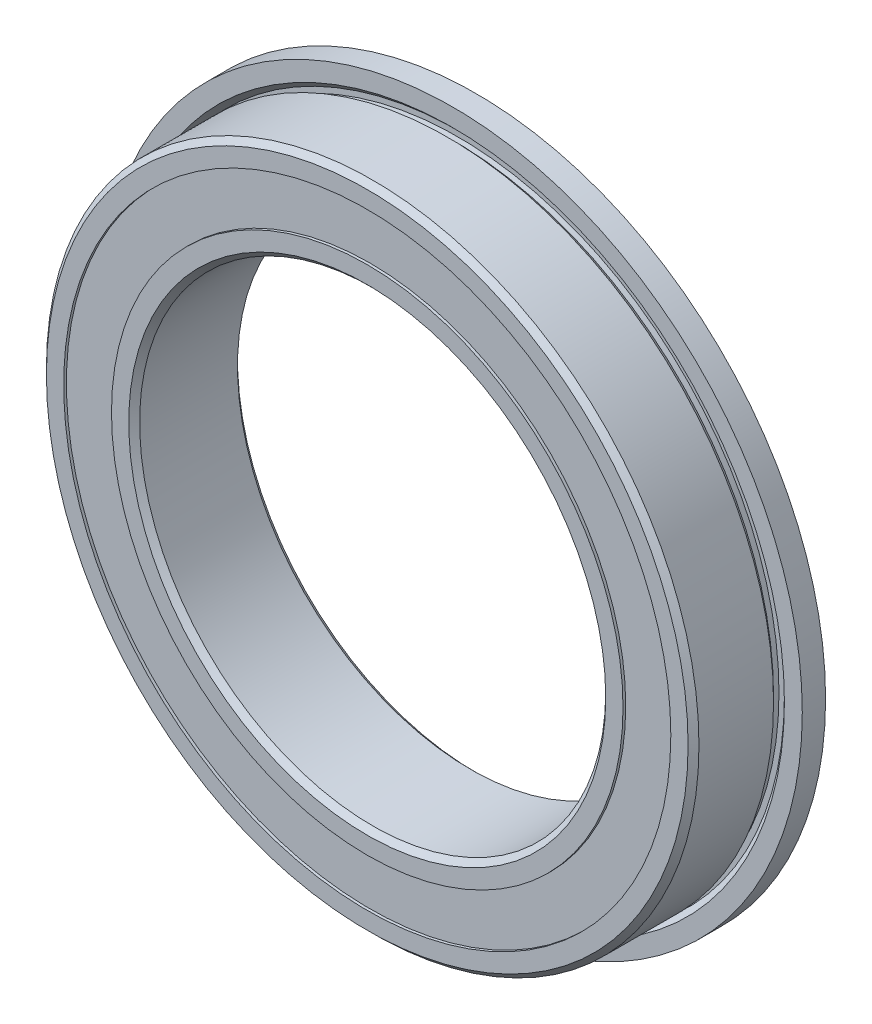
from build123d import *

# Parameters (mm, degrees)
SKETCH6_W         = 0.512820512
SKETCH6_H         = 1.538461538
CIRPATTERN1_COUNT = 17
SKETCH5_W         = 1.137166142
SKETCH5_H         = 3.076923076


with BuildPart() as part:
    # Sketch7 → Revolve7 (revolve)
    with BuildSketch(Plane(origin=(0, 0, 0), x_dir=(0, 0, -1), z_dir=(1, 0, 0))):
        with BuildLine():
            Line((3.5, 22.5), (2, 22.5))
            Line((2, 22.5), (2, 21.35))
            Line((2, 21.35), (2.35, 21))
            Line((2.35, 21), (2.35, 20.65))
            Line((2.35, 20.65), (2, 20.65))
            Line((2, 20.65), (1.65, 21))
            Line((1.65, 21), (-3.15, 21))
            Line((-3.15, 21), (-3.5, 20.65))
            Line((-3.5, 20.65), (-3.5, 19.538461538))
            Line((-3.5, 19.538461538), (-1.555555556, 19.538461538))
            ThreePointArc((-1.555555556, 19.538461538), (0, 20.187833858), (1.555555556, 19.538461538))
            Line((1.555555556, 19.538461538), (3.5, 19.538461538))
            Line((3.5, 19.538461538), (3.5, 20.65))
            Line((3.5, 20.65), (3.5, 22.5))
        make_face()
    revolve(axis=Axis((0, 0, 3.5), (0, 0, -1)))


with BuildPart() as body_2:
    # Sketch3 → Revolve3 (revolve)
    with BuildSketch(Plane(origin=(0, 0, 0), x_dir=(0, 0, -1), z_dir=(1, 0, 0))):
        with BuildLine():
            Line((-3.5, 16.461538462), (-1.555555556, 16.461538462))
            ThreePointArc((-1.555555556, 16.461538462), (0, 15.812166142), (1.555555556, 16.461538462))
            Line((1.555555556, 16.461538462), (3.5, 16.461538462))
            Line((3.5, 16.461538462), (3.5, 15.35))
            Line((3.5, 15.35), (3.15, 15))
            Line((3.15, 15), (-3.15, 15))
            Line((-3.15, 15), (-3.5, 15.35))
            Line((-3.5, 15.35), (-3.5, 16.461538462))
        make_face()
    revolve(axis=Axis((0, 0, 3.5), (0, 0, -1)))


with BuildPart() as body_3:
    # Sketch6 → Revolve6 (revolve)
    with BuildSketch(Plane(origin=(0, 0, 0), x_dir=(0, 0, -1), z_dir=(1, 0, 0))):
        with Locations((0, 18)):
            Rectangle(SKETCH6_W, SKETCH6_H)
    revolve(axis=Axis((0, 0, 3.5), (0, 0, -1)))


with BuildPart() as body_4:
    # Sketch4 → Revolve4 (revolve)
    with BuildSketch(Plane(origin=(0, 0, 0), x_dir=(0, 0, -1), z_dir=(1, 0, 0))):
        with BuildLine():
            Line((-2.187833858, 18), (2.187833858, 18))
            ThreePointArc((2.187833858, 18), (0, 20.187833858), (-2.187833858, 18))
        make_face()
    revolve(axis=Axis((0, 18, 2.187833858), (0, 0, -1)))


with BuildPart() as cirpattern1_1:
    # CirPattern1: pattern copy
    add(body_4.part.rotate(Axis((0, 0, -3.5), (0, 0, 1)), 1 * 360 / CIRPATTERN1_COUNT))


with BuildPart() as cirpattern1_2:
    # CirPattern1: pattern copy
    add(body_4.part.rotate(Axis((0, 0, -3.5), (0, 0, 1)), 2 * 360 / CIRPATTERN1_COUNT))


with BuildPart() as cirpattern1_3:
    # CirPattern1: pattern copy
    add(body_4.part.rotate(Axis((0, 0, -3.5), (0, 0, 1)), 3 * 360 / CIRPATTERN1_COUNT))


with BuildPart() as cirpattern1_4:
    # CirPattern1: pattern copy
    add(body_4.part.rotate(Axis((0, 0, -3.5), (0, 0, 1)), 4 * 360 / CIRPATTERN1_COUNT))


with BuildPart() as cirpattern1_5:
    # CirPattern1: pattern copy
    add(body_4.part.rotate(Axis((0, 0, -3.5), (0, 0, 1)), 5 * 360 / CIRPATTERN1_COUNT))


with BuildPart() as cirpattern1_6:
    # CirPattern1: pattern copy
    add(body_4.part.rotate(Axis((0, 0, -3.5), (0, 0, 1)), 6 * 360 / CIRPATTERN1_COUNT))


with BuildPart() as cirpattern1_7:
    # CirPattern1: pattern copy
    add(body_4.part.rotate(Axis((0, 0, -3.5), (0, 0, 1)), 7 * 360 / CIRPATTERN1_COUNT))


with BuildPart() as cirpattern1_8:
    # CirPattern1: pattern copy
    add(body_4.part.rotate(Axis((0, 0, -3.5), (0, 0, 1)), 8 * 360 / CIRPATTERN1_COUNT))


with BuildPart() as cirpattern1_9:
    # CirPattern1: pattern copy
    add(body_4.part.rotate(Axis((0, 0, -3.5), (0, 0, 1)), 9 * 360 / CIRPATTERN1_COUNT))


with BuildPart() as cirpattern1_10:
    # CirPattern1: pattern copy
    add(body_4.part.rotate(Axis((0, 0, -3.5), (0, 0, 1)), 10 * 360 / CIRPATTERN1_COUNT))


with BuildPart() as cirpattern1_11:
    # CirPattern1: pattern copy
    add(body_4.part.rotate(Axis((0, 0, -3.5), (0, 0, 1)), 11 * 360 / CIRPATTERN1_COUNT))


with BuildPart() as cirpattern1_12:
    # CirPattern1: pattern copy
    add(body_4.part.rotate(Axis((0, 0, -3.5), (0, 0, 1)), 12 * 360 / CIRPATTERN1_COUNT))


with BuildPart() as cirpattern1_13:
    # CirPattern1: pattern copy
    add(body_4.part.rotate(Axis((0, 0, -3.5), (0, 0, 1)), 13 * 360 / CIRPATTERN1_COUNT))


with BuildPart() as cirpattern1_14:
    # CirPattern1: pattern copy
    add(body_4.part.rotate(Axis((0, 0, -3.5), (0, 0, 1)), 14 * 360 / CIRPATTERN1_COUNT))


with BuildPart() as cirpattern1_15:
    # CirPattern1: pattern copy
    add(body_4.part.rotate(Axis((0, 0, -3.5), (0, 0, 1)), 15 * 360 / CIRPATTERN1_COUNT))


with BuildPart() as cirpattern1_16:
    # CirPattern1: pattern copy
    add(body_4.part.rotate(Axis((0, 0, -3.5), (0, 0, 1)), 16 * 360 / CIRPATTERN1_COUNT))


with BuildPart() as body_21:
    # Sketch5 → Revolve5 (revolve)
    with BuildSketch(Plane(origin=(0, 0, 0), x_dir=(0, 0, -1), z_dir=(1, 0, 0))):
        with Locations((-2.756416929, 18)):
            Rectangle(SKETCH5_W, SKETCH5_H)
        with Locations((2.756416929, 18)):
            Rectangle(SKETCH5_W, SKETCH5_H)
    revolve(axis=Axis((0, 0, 3.5), (0, 0, -1)))


solid = Compound([part.part, body_2.part, body_3.part, body_4.part, cirpattern1_1.part, cirpattern1_2.part, cirpattern1_3.part, cirpattern1_4.part, cirpattern1_5.part, cirpattern1_6.part, cirpattern1_7.part, cirpattern1_8.part, cirpattern1_9.part, cirpattern1_10.part, cirpattern1_11.part, cirpattern1_12.part, cirpattern1_13.part, cirpattern1_14.part, cirpattern1_15.part, cirpattern1_16.part, body_21.part])
